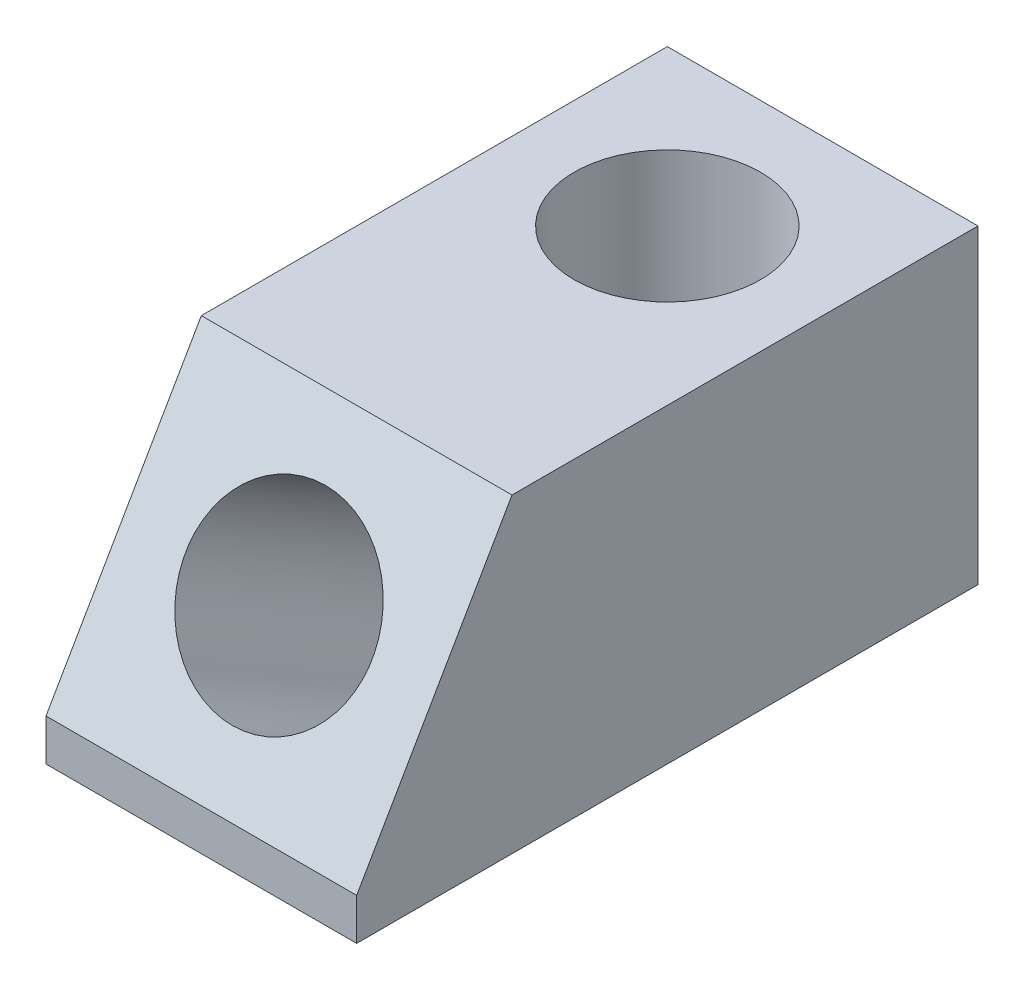
from build123d import *

# Parameters (mm, degrees)
SKETCH_1_W          = 5
SKETCH_1_H          = 10
SKETCH_1_R          = 1.5
EXTRUDE_1_DEPTH     = 5
CUT_EXTRUDE_1_DEPTH = 5
SKETCH_3_R          = 1.5
CUT_EXTRUDE_2_DEPTH = 13.419290245


with BuildPart() as part:
    # 草图1 → 凸台-拉伸1 (new body)
    with BuildSketch(Plane(origin=(0, 0, 0), x_dir=(1, 0, 0), z_dir=(0, 1, 0))):
        with Locations((2.5, 5)):
            Rectangle(SKETCH_1_W, SKETCH_1_H)
        with Locations(Location((2.5, 7.5, 0), (0, 0, 270))):
            Circle(SKETCH_1_R, mode=Mode.SUBTRACT)
    extrude(amount=EXTRUDE_1_DEPTH)

    # 草图2 → 切除-拉伸1 (cut)
    with BuildSketch(Plane(origin=(5, 0, 0), x_dir=(0, 0, -1), z_dir=(1, 0, 0))):
        Polygon((0, 0.669872981), (2.5, 5), (0, 5), align=None)
    extrude(amount=-CUT_EXTRUDE_1_DEPTH, mode=Mode.SUBTRACT)

    # 草图3 → 切除-拉伸2 (cut, through all)
    with BuildSketch(Plane(origin=(0, 0.167468245, 0.290063509), x_dir=(1, 0, 0), z_dir=(0, 0.4999999999999979, 0.8660254037844399))):
        with Locations(Location((2.5, 3.080127019, 0), (0, 0, 270))):
            Circle(SKETCH_3_R)
    extrude(amount=-CUT_EXTRUDE_2_DEPTH, mode=Mode.SUBTRACT)


solid = part.part
